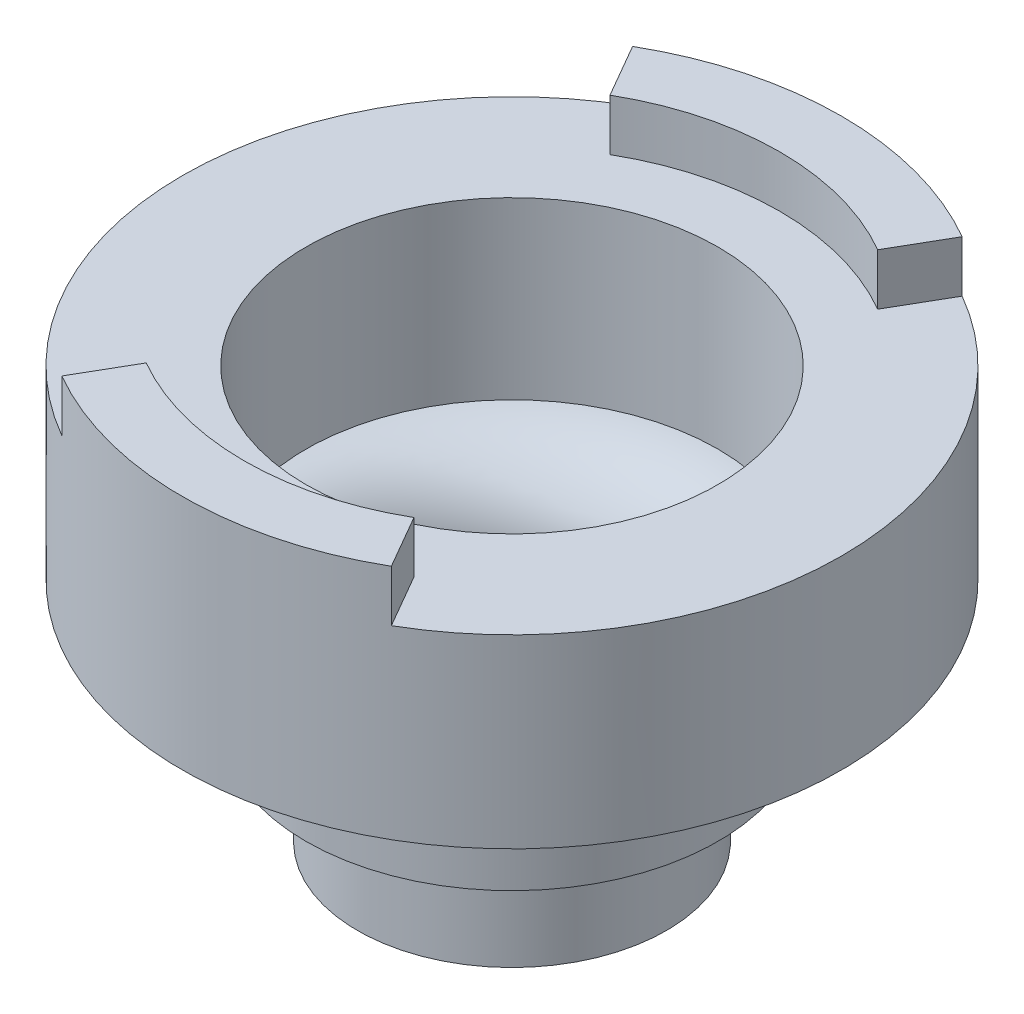
from build123d import *
from build123d.topology import SkipClean

# Parameters (mm, degrees)
SKETCH3_W           = 10
SKETCH3_H           = 15
SKETCH3_W_2         = 18
SKETCH3_H_2         = 32
BOSS_EXTRUDE2_DEPTH = 5
SKETCH5_R           = 8
CUT_EXTRUDE1_DEPTH  = 64.820059542
SKETCH6_W           = 17
SKETCH6_H           = 20


with BuildPart() as part:
    # Sketch3 → Revolve1 (revolve)
    with BuildSketch(Plane.YZ, mode=Mode.PRIVATE) as revolve1_sk:
        with Locations((-35, 7.5)):
            Rectangle(SKETCH3_W, SKETCH3_H)
        Polygon((-30, 0), (-25, 0), (-25, 20), (-30, 20), (-30, 15), align=None)
        Polygon((-25, 0), (-18, 0), (-18, 32), (-25, 20), align=None)
        with Locations((-9, 16)):
            Rectangle(SKETCH3_W_2, SKETCH3_H_2)
    revolve(revolve1_sk.sketch.rotate(Axis((0, -68.119839204, 0), (0, 1, 0)), 180), axis=Axis((0, -68.119839204, 0), (0, 1, 0)))

    # Sketch4 → Boss-Extrude2 (add)
    with SkipClean():  # the faces are left unmerged after this step: merging them gives an invalid solid
        with BuildSketch(Plane(origin=(0, 0, 0), x_dir=(-1, 0, 0), z_dir=(0, 1, 0))):
            with BuildLine():
                Line((-13, -22.516660498), (-16, -27.712812921))
                ThreePointArc((-16, -27.712812921), (0, -32), (16, -27.712812921))
                Line((16, -27.712812921), (13, -22.516660498))
                ThreePointArc((13, -22.516660498), (0, -26), (-13, -22.516660498))
            make_face()
            with BuildLine():
                Line((-13, 22.516660498), (-16, 27.712812921))
                ThreePointArc((-16, 27.712812921), (0, 32), (16, 27.712812921))
                Line((16, 27.712812921), (13, 22.516660498))
                ThreePointArc((13, 22.516660498), (0, 26), (-13, 22.516660498))
            make_face()
        extrude(amount=BOSS_EXTRUDE2_DEPTH)

    # Sketch5 → Cut-Extrude1 (cut, through all)
    with SkipClean():  # the faces are left unmerged after this step: merging them gives an invalid solid
        with BuildSketch(Plane.XZ.offset(40)):
            with Locations(Location((0, 0, 0), (0, 0, 270))):
                Circle(SKETCH5_R)
        extrude(amount=-CUT_EXTRUDE1_DEPTH, mode=Mode.SUBTRACT)

    # Sketch6 → Cut-Revolve1 (revolve, cut)
    with SkipClean():  # the faces are left unmerged after this step: merging them gives an invalid solid
        with BuildSketch(Plane.YZ, mode=Mode.PRIVATE) as cut_revolve1_sk:
            with Locations((-8.5, 10)):
                Rectangle(SKETCH6_W, SKETCH6_H)
            with BuildLine():
                Line((-17, 0), (-17, 20))
                ThreePointArc((-17, 20), (-19.343145751, 14.343145751), (-25, 12))
                Line((-25, 12), (-25, 0))
                Line((-25, 0), (-17, 0))
            make_face()
        revolve(cut_revolve1_sk.sketch.rotate(Axis((0, 48.192751934, 0), (0, -1, 0)), 180), axis=Axis((0, 48.192751934, 0), (0, -1, 0)), mode=Mode.SUBTRACT)


solid = part.part
